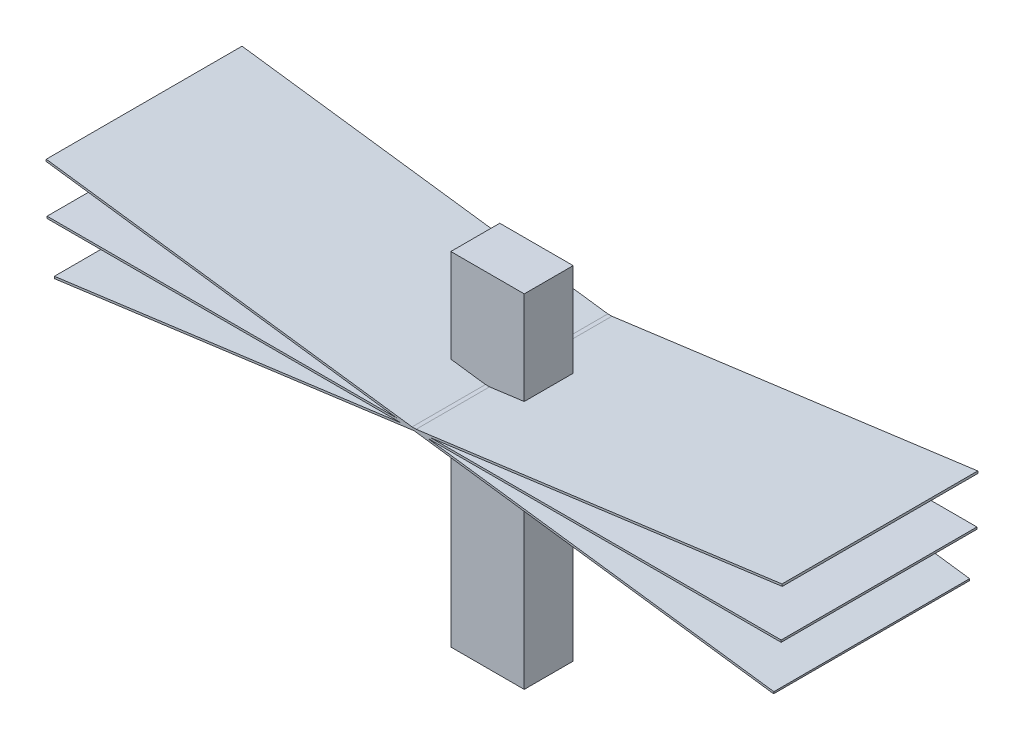
from build123d import *

# Parameters (mm, degrees)
SKETCH1_W           = 457.2
SKETCH1_H           = 2133.6
BOSS_EXTRUDE1_DEPTH = 152.4
BOSS_EXTRUDE2_DEPTH = 609.6


with BuildPart() as part:
    # Sketch1 → Boss-Extrude1 (new, symmetric)
    with BuildSketch(Plane.XY):
        with Locations((0, 1066.8)):
            Rectangle(SKETCH1_W, SKETCH1_H)
    extrude(amount=BOSS_EXTRUDE1_DEPTH, both=True)

    # Sketch2 → Boss-Extrude2 (add, symmetric)
    with BuildSketch(Plane.XY):
        Polygon((12.68592016, 1524), (-2286, 1524), (-2286, 1511.3), (-82.246931836, 1511.3), align=None)
        Polygon((13.531648171, 1511.3), (-82.246931836, 1511.3), (-2240.554721608, 1222.564242527), (-2238.870733393, 1209.976383945), align=None)
        Polygon((108.464500167, 1524), (12.68592016, 1524), (-82.246931836, 1511.3), (13.531648171, 1511.3), align=None)
        Polygon((2291.074368064, 1828.8), (12.68592016, 1524), (108.464500167, 1524), (2292.758356279, 1816.212141418), align=None)
        Polygon((2286, 1524), (108.464500167, 1524), (13.531648171, 1511.3), (2286, 1511.3), align=None)
    boss_extrude2 = extrude(amount=BOSS_EXTRUDE2_DEPTH, both=True)

    # Mirror1: Boss-Extrude2 across plane
    add(boss_extrude2.mirror(Plane(origin=(0, 0, 0), x_dir=(0, 0, 1), z_dir=(1, 0, 0))))


solid = part.part
